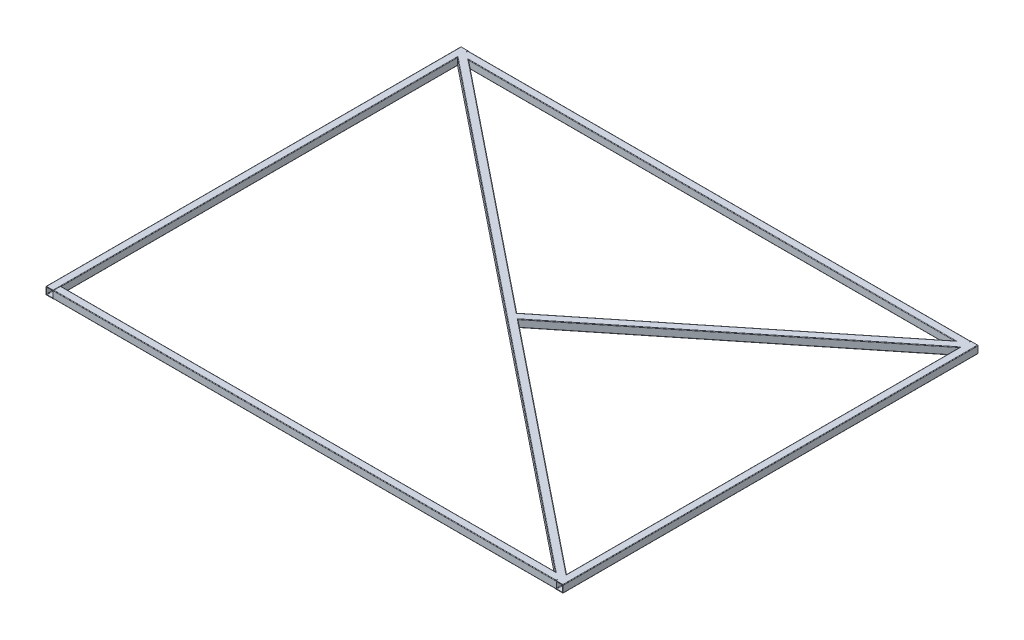
from build123d import *

# Parameters (mm, degrees)
BOSS_EXTRUDE1_DEPTH             = 2125
BOSS_EXTRUDE2_DEPTH             = 2573.8
BOSS_EXTRUDE5_REACH             = 1700.499
BOSS_EXTRUDE5_DIRECTION_2_REACH = 1700.499
BOSS_EXTRUDE7_REACH             = 3326.514
BOSS_EXTRUDE7_DIRECTION_2_REACH = 3326.514


with BuildPart() as part:
    # Sketch2 → Boss-Extrude1 (new body)
    with BuildSketch(Plane.XY):
        with BuildLine():
            Line((2.54, 18.93544774), (35.56, 18.93544774))
            ThreePointArc((35.56, 18.93544774), (37.356051224, 18.191498964), (38.1, 16.39544774))
            Line((38.1, 16.39544774), (38.1, -16.62455226))
            ThreePointArc((38.1, -16.62455226), (37.356051224, -18.420603484), (35.56, -19.16455226))
            Line((35.56, -19.16455226), (2.54, -19.16455226))
            ThreePointArc((2.54, -19.16455226), (0.743948776, -18.420603484), (0, -16.62455226))
            Line((0, -16.62455226), (0, 16.39544774))
            ThreePointArc((0, 16.39544774), (0.743948776, 18.191498964), (2.54, 18.93544774))
        make_face()
        with BuildLine():
            Line((5.3086, 16.16684774), (32.7914, 16.16684774))
            ThreePointArc((32.7914, 16.16684774), (34.587451224, 15.422898964), (35.3314, 13.62684774))
            Line((35.3314, 13.62684774), (35.3314, -13.85595226))
            ThreePointArc((35.3314, -13.85595226), (34.587451224, -15.652003484), (32.7914, -16.39595226))
            Line((32.7914, -16.39595226), (5.3086, -16.39595226))
            ThreePointArc((5.3086, -16.39595226), (3.512548776, -15.652003484), (2.7686, -13.85595226))
            Line((2.7686, -13.85595226), (2.7686, 13.62684774))
            ThreePointArc((2.7686, 13.62684774), (3.512548776, 15.422898964), (5.3086, 16.16684774))
        make_face(mode=Mode.SUBTRACT)
    extrude(amount=BOSS_EXTRUDE1_DEPTH)


with BuildPart() as body_2:
    # Mirror2: mirrored copy
    add(part.part.mirror(Plane.ZY.offset(-1325)))


with BuildPart() as part_1:
    add(part.part)

    add(body_2.part)  # Boss-Extrude2 merges body 2
    # Sketch3 → Boss-Extrude2 (add)
    with BuildSketch(Plane.ZY.offset(-2611.9)):
        with BuildLine():
            Line((2.54, 18.93544774), (35.56, 18.93544774))
            ThreePointArc((35.56, 18.93544774), (37.356051224, 18.191498964), (38.1, 16.39544774))
            Line((38.1, 16.39544774), (38.1, -16.62455226))
            ThreePointArc((38.1, -16.62455226), (37.356051224, -18.420603484), (35.56, -19.16455226))
            Line((35.56, -19.16455226), (2.54, -19.16455226))
            ThreePointArc((2.54, -19.16455226), (0.743948776, -18.420603484), (0, -16.62455226))
            Line((0, -16.62455226), (0, 16.39544774))
            ThreePointArc((0, 16.39544774), (0.743948776, 18.191498964), (2.54, 18.93544774))
        make_face()
        with BuildLine():
            Line((5.3086, 16.16684774), (32.7914, 16.16684774))
            ThreePointArc((32.7914, 16.16684774), (34.587451224, 15.422898964), (35.3314, 13.62684774))
            Line((35.3314, 13.62684774), (35.3314, -13.85595226))
            ThreePointArc((35.3314, -13.85595226), (34.587451224, -15.652003484), (32.7914, -16.39595226))
            Line((32.7914, -16.39595226), (5.3086, -16.39595226))
            ThreePointArc((5.3086, -16.39595226), (3.512548776, -15.652003484), (2.7686, -13.85595226))
            Line((2.7686, -13.85595226), (2.7686, 13.62684774))
            ThreePointArc((2.7686, 13.62684774), (3.512548776, 15.422898964), (5.3086, 16.16684774))
        make_face(mode=Mode.SUBTRACT)
    boss_extrude2 = extrude(amount=BOSS_EXTRUDE2_DEPTH)

    # Mirror3: Boss-Extrude2 across plane
    add(boss_extrude2.mirror(Plane.XY.offset(1062.5)))

    # Sketch8 → Boss-Extrude5 (add, up to next)
    with BuildSketch(Plane(origin=(1325, 0, 1062.5), x_dir=(-0.6255921846507733, 0, 0.7801502537997875), z_dir=(-0.7801502537997875, 0, -0.6255921846507733)), mode=Mode.PRIVATE) as boss_extrude5_sk1:
        with BuildLine():
            Line((-16.51, 18.93544774), (16.51, 18.93544774))
            ThreePointArc((16.51, 18.93544774), (18.306051224, 18.191498964), (19.05, 16.39544774))
            Line((19.05, 16.39544774), (19.05, -16.62455226))
            ThreePointArc((19.05, -16.62455226), (18.306051224, -18.420603484), (16.51, -19.16455226))
            Line((16.51, -19.16455226), (-16.51, -19.16455226))
            ThreePointArc((-16.51, -19.16455226), (-18.306051224, -18.420603484), (-19.05, -16.62455226))
            Line((-19.05, -16.62455226), (-19.05, 16.39544774))
            ThreePointArc((-19.05, 16.39544774), (-18.306051224, 18.191498964), (-16.51, 18.93544774))
        make_face()
        with BuildLine():
            Line((16.2814, 13.62684774), (16.2814, -13.85595226))
            ThreePointArc((16.2814, -13.85595226), (15.537451224, -15.652003484), (13.7414, -16.39595226))
            Line((13.7414, -16.39595226), (-13.7414, -16.39595226))
            ThreePointArc((-13.7414, -16.39595226), (-15.537451224, -15.652003484), (-16.2814, -13.85595226))
            Line((-16.2814, -13.85595226), (-16.2814, 13.62684774))
            ThreePointArc((-16.2814, 13.62684774), (-15.537451224, 15.422898964), (-13.7414, 16.16684774))
            Line((-13.7414, 16.16684774), (13.7414, 16.16684774))
            ThreePointArc((13.7414, 16.16684774), (15.537451224, 15.422898964), (16.2814, 13.62684774))
        make_face(mode=Mode.SUBTRACT)
    boss_extrude5_tool1 = extrude(boss_extrude5_sk1.sketch, amount=-BOSS_EXTRUDE5_REACH, mode=Mode.PRIVATE) - part_1.part
    add(boss_extrude5_tool1.solids().sort_by_distance((1336.213772, 17.810499, 1048.515767))[0])

    # Sketch8 → Boss-Extrude5 direction 2 (add, up to next)
    with BuildSketch(Plane(origin=(1325, 0, 1062.5), x_dir=(-0.6255921846507733, 0, 0.7801502537997875), z_dir=(-0.7801502537997875, 0, -0.6255921846507733)), mode=Mode.PRIVATE) as boss_extrude5_direction_2_sk1:
        with BuildLine():
            Line((-16.51, 18.93544774), (16.51, 18.93544774))
            ThreePointArc((16.51, 18.93544774), (18.306051224, 18.191498964), (19.05, 16.39544774))
            Line((19.05, 16.39544774), (19.05, -16.62455226))
            ThreePointArc((19.05, -16.62455226), (18.306051224, -18.420603484), (16.51, -19.16455226))
            Line((16.51, -19.16455226), (-16.51, -19.16455226))
            ThreePointArc((-16.51, -19.16455226), (-18.306051224, -18.420603484), (-19.05, -16.62455226))
            Line((-19.05, -16.62455226), (-19.05, 16.39544774))
            ThreePointArc((-19.05, 16.39544774), (-18.306051224, 18.191498964), (-16.51, 18.93544774))
        make_face()
        with BuildLine():
            Line((16.2814, 13.62684774), (16.2814, -13.85595226))
            ThreePointArc((16.2814, -13.85595226), (15.537451224, -15.652003484), (13.7414, -16.39595226))
            Line((13.7414, -16.39595226), (-13.7414, -16.39595226))
            ThreePointArc((-13.7414, -16.39595226), (-15.537451224, -15.652003484), (-16.2814, -13.85595226))
            Line((-16.2814, -13.85595226), (-16.2814, 13.62684774))
            ThreePointArc((-16.2814, 13.62684774), (-15.537451224, 15.422898964), (-13.7414, 16.16684774))
            Line((-13.7414, 16.16684774), (13.7414, 16.16684774))
            ThreePointArc((13.7414, 16.16684774), (15.537451224, 15.422898964), (16.2814, 13.62684774))
        make_face(mode=Mode.SUBTRACT)
    boss_extrude5_direction_2_tool1 = extrude(boss_extrude5_direction_2_sk1.sketch, amount=BOSS_EXTRUDE5_DIRECTION_2_REACH, mode=Mode.PRIVATE) - part_1.part
    add(boss_extrude5_direction_2_tool1.solids().sort_by_distance((1336.213772, 17.810499, 1048.515767))[0])

    # Sketch11 → Boss-Extrude7 (add, up to next)
    with BuildSketch(Plane(origin=(386.960291268, 0, -310.298346771), x_dir=(-0.6255921846507708, 0, -0.7801502537997894), z_dir=(0.7801502537997894, 0, -0.6255921846507708)), mode=Mode.PRIVATE) as boss_extrude7_sk1:
        with BuildLine():
            Line((-1674.329289325, 18.93544774), (-1641.309289325, 18.93544774))
            ThreePointArc((-1641.309289325, 18.93544774), (-1639.5132381, 18.191498964), (-1638.769289325, 16.39544774))
            Line((-1638.769289325, 16.39544774), (-1638.769289325, -16.62455226))
            ThreePointArc((-1638.769289325, -16.62455226), (-1639.5132381, -18.420603484), (-1641.309289325, -19.16455226))
            Line((-1641.309289325, -19.16455226), (-1674.329289325, -19.16455226))
            ThreePointArc((-1674.329289325, -19.16455226), (-1676.125340549, -18.420603484), (-1676.869289325, -16.62455226))
            Line((-1676.869289325, -16.62455226), (-1676.869289325, 16.39544774))
            ThreePointArc((-1676.869289325, 16.39544774), (-1676.125340549, 18.191498964), (-1674.329289325, 18.93544774))
        make_face()
        with BuildLine():
            Line((-1671.560689325, 16.16684774), (-1644.077889325, 16.16684774))
            ThreePointArc((-1644.077889325, 16.16684774), (-1642.2818381, 15.422898964), (-1641.537889325, 13.62684774))
            Line((-1641.537889325, 13.62684774), (-1641.537889325, -13.85595226))
            ThreePointArc((-1641.537889325, -13.85595226), (-1642.2818381, -15.652003484), (-1644.077889325, -16.39595226))
            Line((-1644.077889325, -16.39595226), (-1671.560689325, -16.39595226))
            ThreePointArc((-1671.560689325, -16.39595226), (-1673.356740549, -15.652003484), (-1674.100689325, -13.85595226))
            Line((-1674.100689325, -13.85595226), (-1674.100689325, 13.62684774))
            ThreePointArc((-1674.100689325, 13.62684774), (-1673.356740549, 15.422898964), (-1671.560689325, 16.16684774))
        make_face(mode=Mode.SUBTRACT)
    boss_extrude7_tool1 = extrude(boss_extrude7_sk1.sketch, amount=-BOSS_EXTRUDE7_REACH, mode=Mode.PRIVATE) - part_1.part
    add(boss_extrude7_tool1.solids().sort_by_distance((1424.079082, 18.396632, 983.049793))[0])

    # Sketch11 → Boss-Extrude7 direction 2 (add, up to next)
    with BuildSketch(Plane(origin=(386.960291268, 0, -310.298346771), x_dir=(-0.6255921846507708, 0, -0.7801502537997894), z_dir=(0.7801502537997894, 0, -0.6255921846507708)), mode=Mode.PRIVATE) as boss_extrude7_direction_2_sk1:
        with BuildLine():
            Line((-1674.329289325, 18.93544774), (-1641.309289325, 18.93544774))
            ThreePointArc((-1641.309289325, 18.93544774), (-1639.5132381, 18.191498964), (-1638.769289325, 16.39544774))
            Line((-1638.769289325, 16.39544774), (-1638.769289325, -16.62455226))
            ThreePointArc((-1638.769289325, -16.62455226), (-1639.5132381, -18.420603484), (-1641.309289325, -19.16455226))
            Line((-1641.309289325, -19.16455226), (-1674.329289325, -19.16455226))
            ThreePointArc((-1674.329289325, -19.16455226), (-1676.125340549, -18.420603484), (-1676.869289325, -16.62455226))
            Line((-1676.869289325, -16.62455226), (-1676.869289325, 16.39544774))
            ThreePointArc((-1676.869289325, 16.39544774), (-1676.125340549, 18.191498964), (-1674.329289325, 18.93544774))
        make_face()
        with BuildLine():
            Line((-1671.560689325, 16.16684774), (-1644.077889325, 16.16684774))
            ThreePointArc((-1644.077889325, 16.16684774), (-1642.2818381, 15.422898964), (-1641.537889325, 13.62684774))
            Line((-1641.537889325, 13.62684774), (-1641.537889325, -13.85595226))
            ThreePointArc((-1641.537889325, -13.85595226), (-1642.2818381, -15.652003484), (-1644.077889325, -16.39595226))
            Line((-1644.077889325, -16.39595226), (-1671.560689325, -16.39595226))
            ThreePointArc((-1671.560689325, -16.39595226), (-1673.356740549, -15.652003484), (-1674.100689325, -13.85595226))
            Line((-1674.100689325, -13.85595226), (-1674.100689325, 13.62684774))
            ThreePointArc((-1674.100689325, 13.62684774), (-1673.356740549, 15.422898964), (-1671.560689325, 16.16684774))
        make_face(mode=Mode.SUBTRACT)
    boss_extrude7_direction_2_tool1 = extrude(boss_extrude7_direction_2_sk1.sketch, amount=BOSS_EXTRUDE7_DIRECTION_2_REACH, mode=Mode.PRIVATE) - part_1.part
    add(boss_extrude7_direction_2_tool1.solids().sort_by_distance((1424.079082, 18.396632, 983.049793))[0])


solid = part_1.part
